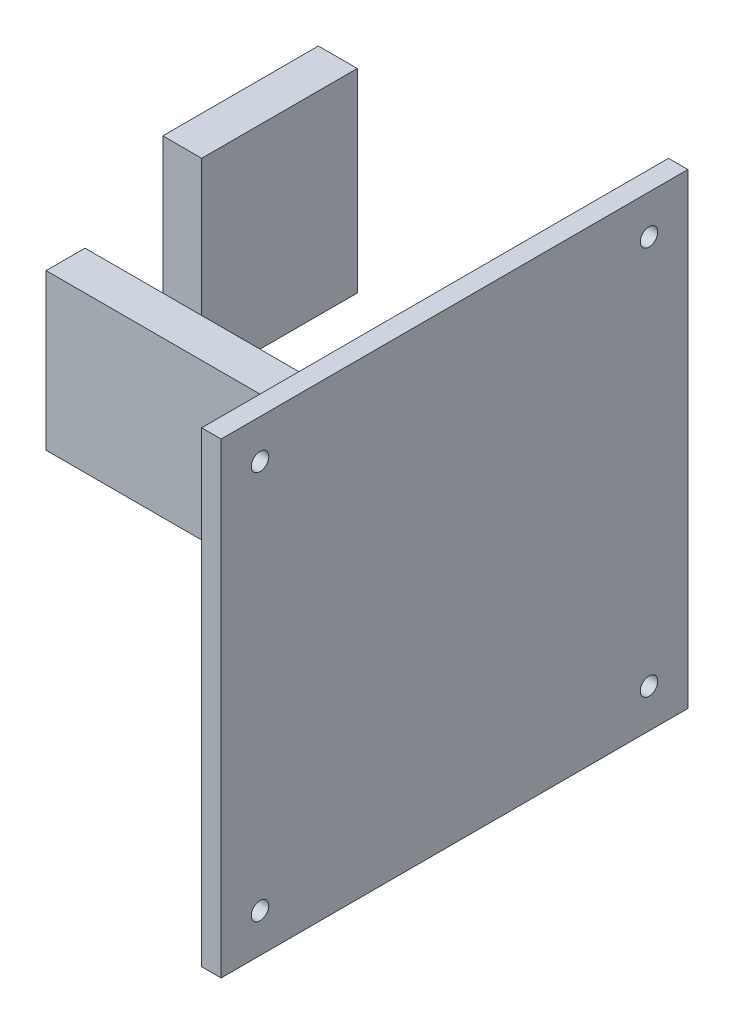
from build123d import *

# Parameters (mm, degrees)
SKETCH1_W           = 40
SKETCH1_H           = 50
BOSS_EXTRUDE1_DEPTH = 10
SKETCH2_W           = 100
SKETCH2_H           = 40
BOSS_EXTRUDE2_DEPTH = 10
SKETCH3_W           = 120
SKETCH3_H           = 120
BOSS_EXTRUDE3_DEPTH = 5
SKETCH4_R           = 2.25
CUT_EXTRUDE1_DEPTH  = 10


with BuildPart() as part:
    # Sketch1 → Boss-Extrude1 (new body)
    with BuildSketch(Plane(origin=(0, 0, 0), x_dir=(0, 0, -1), z_dir=(1, 0, 0))):
        Rectangle(SKETCH1_W, SKETCH1_H)
    extrude(amount=BOSS_EXTRUDE1_DEPTH)


with BuildPart() as body_2:
    # Sketch2 → Boss-Extrude2 (new body)
    with BuildSketch(Plane.XY.offset(50)):
        with Locations((60, 0)):
            Rectangle(SKETCH2_W, SKETCH2_H)
    extrude(amount=BOSS_EXTRUDE2_DEPTH)

    # Sketch3 → Boss-Extrude3 (add)
    with BuildSketch(Plane(origin=(110, 0, 0), x_dir=(0, 0, -1), z_dir=(1, 0, 0))):
        with Locations((-55, 0)):
            Rectangle(SKETCH3_W, SKETCH3_H)
    extrude(amount=-BOSS_EXTRUDE3_DEPTH)

    # Sketch4 → Cut-Extrude1 (cut)
    with BuildSketch(Plane(origin=(110, 0, 0), x_dir=(0, 0, -1), z_dir=(1, 0, 0))):
        with Locations((-105, -50)):
            Circle(SKETCH4_R)
        with Locations((-105, 50)):
            Circle(SKETCH4_R)
        with Locations((-5, -50)):
            Circle(SKETCH4_R)
        with Locations((-5, 50)):
            Circle(SKETCH4_R)
    extrude(amount=-CUT_EXTRUDE1_DEPTH, mode=Mode.SUBTRACT)


solid = Compound([part.part, body_2.part])
